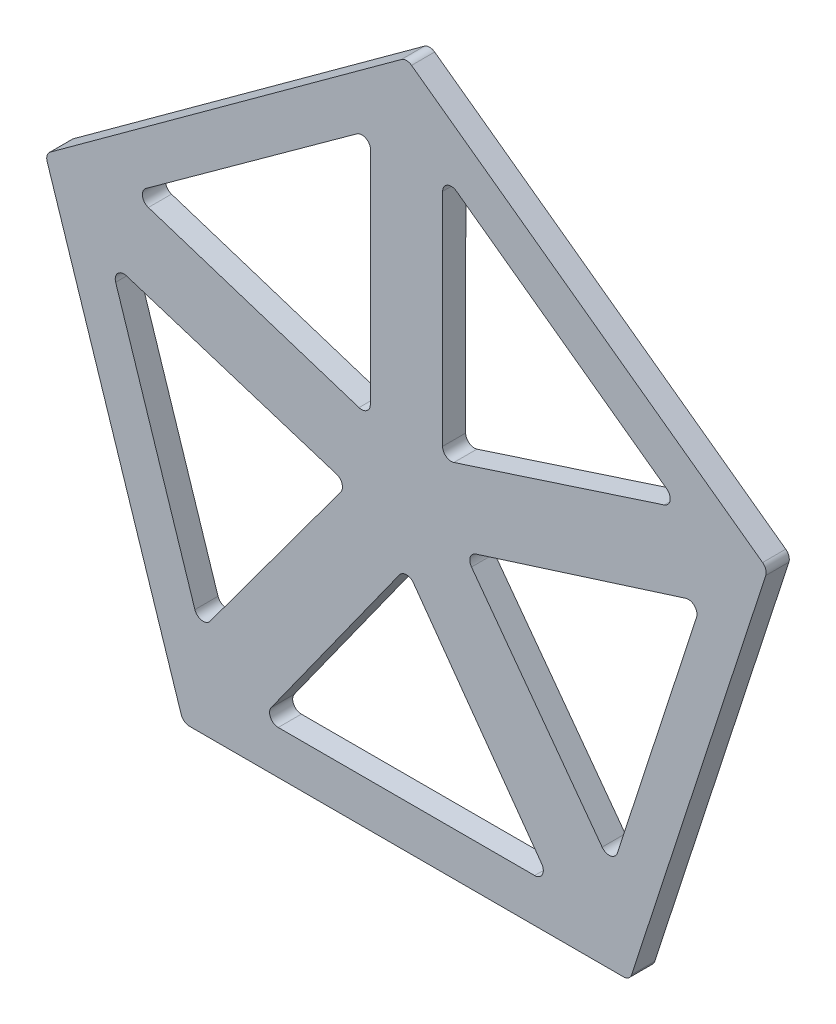
from build123d import *

# Parameters (mm, degrees)
PCB_THICKNESS_DEPTH = 1.6


with BuildPart() as part:
    # Model → PCB Thickness (new body)
    with BuildSketch(Plane.XY):
        with BuildLine():
            ThreePointArc((-24.647921054, 8.326484664), (-24.865455476, 8.026418687), (-24.865198885, 7.655796575))
            Line((-24.865198885, 7.655796575), (-15.584897999, -20.855706146))
            ThreePointArc((-15.584897999, -20.855706146), (-15.366905589, -21.155501643), (-15.014360333, -21.27))
            Line((-15.014360333, -21.27), (15.014062777, -21.27))
            ThreePointArc((15.014062777, -21.27), (15.366729058, -21.155413735), (15.584692966, -20.855421647))
            Line((15.584692966, -20.855421647), (24.865283806, 7.705350163))
            ThreePointArc((24.865283806, 7.705350163), (24.86528072, 8.07620295), (24.647279393, 8.376214969))
            Line((24.647279393, 8.376214969), (0.353119455, 26.023485868))
            ThreePointArc((0.353119455, 26.023485868), (0.00010165, 26.138042579), (-0.352766154, 26.023024653))
            Line((-0.352766154, 26.023024653), (-24.647921054, 8.326484664))
        make_face()
        with BuildLine():
            ThreePointArc((-20.122996261, 2.786788494), (-19.978077319, 3.395006483), (-19.370866555, 3.544089386))
            Line((-19.370866555, 3.544089386), (-4.846077132, -1.065507257))
            ThreePointArc((-4.846077132, -1.065507257), (-4.456938312, -1.451989932), (-4.544592973, -1.993390467))
            Line((-4.544592973, -1.993390467), (-13.585986389, -14.259981534))
            ThreePointArc((-13.585986389, -14.259981534), (-14.164858865, -14.496276924), (-14.639600254, -14.089399218))
            Line((-14.639600254, -14.089399218), (-20.122996261, 2.786788494))
        make_face(mode=Mode.SUBTRACT)
        with BuildLine():
            ThreePointArc((-8.872358317, -18.27), (-9.406025436, -17.9442251), (-9.36017471, -17.320664685))
            Line((-9.36017471, -17.320664685), (-0.487816395, -4.931187808))
            ThreePointArc((-0.487816395, -4.931187808), (0, -4.680523127), (0.487816395, -4.931187808))
            Line((0.487816395, -4.931187808), (9.36017471, -17.320664685))
            ThreePointArc((9.36017471, -17.320664685), (9.406025435, -17.944225099), (8.872358317, -18.27))
            Line((8.872358317, -18.27), (-8.872358317, -18.27))
        make_face(mode=Mode.SUBTRACT)
        with BuildLine():
            ThreePointArc((14.596200254, -14.061999218), (14.121457712, -14.46887711), (13.542585003, -14.232579653))
            Line((13.542585003, -14.232579653), (4.50125132, -1.965969627))
            ThreePointArc((4.50125132, -1.965969627), (4.413598402, -1.424569864), (4.80273686, -1.038088302))
            Line((4.80273686, -1.038088302), (19.327466555, 3.571489386))
            ThreePointArc((19.327466555, 3.571489386), (19.934677319, 3.422406484), (20.079596261, 2.814188494))
            Line((20.079596261, 2.814188494), (14.596200254, -14.061999218))
        make_face(mode=Mode.SUBTRACT)
        with BuildLine():
            ThreePointArc((-3.432918624, 20.025486513), (-2.807853844, 20.073751171), (-2.481000035, 19.538772626))
            Line((-2.481000035, 19.538772626), (-2.500299876, 4.265097836))
            ThreePointArc((-2.500299876, 4.265097836), (-2.74743143, 3.780639668), (-3.284491549, 3.69496499))
            Line((-3.284491549, 3.69496499), (-17.859258249, 8.399918804))
            ThreePointArc((-17.859258249, 8.399918804), (-18.267531635, 8.876938588), (-18.026854434, 9.45686058))
            Line((-18.026854434, 9.45686058), (-3.432918624, 20.025486513))
        make_face(mode=Mode.SUBTRACT)
        with BuildLine():
            ThreePointArc((18.008187001, 9.478509434), (18.248398797, 8.899239554), (17.841223922, 8.422307775))
            Line((17.841223922, 8.422307775), (3.284260895, 3.69088729))
            ThreePointArc((3.284260895, 3.69088729), (2.746034776, 3.776162456), (2.498798945, 4.261789527))
            Line((2.498798945, 4.261789527), (2.506100046, 19.552295755))
            ThreePointArc((2.506100046, 19.552295755), (2.83391858, 20.086965957), (3.459163763, 20.037918253))
            Line((3.459163763, 20.037918253), (18.008187001, 9.478509434))
        make_face(mode=Mode.SUBTRACT)
    extrude(amount=PCB_THICKNESS_DEPTH)


solid = part.part
